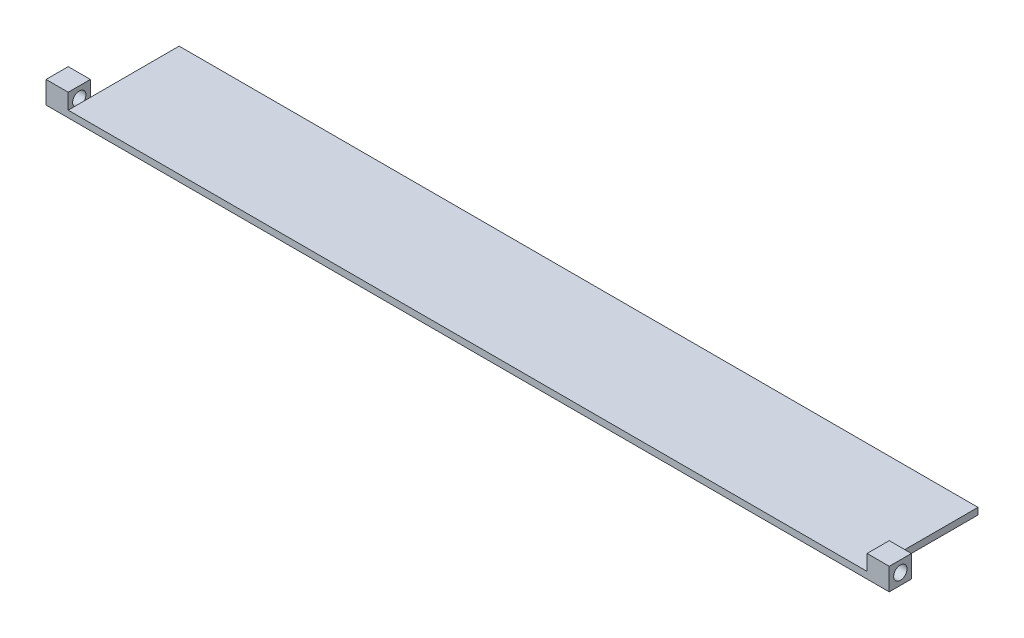
from build123d import *

# Parameters (mm, degrees)
SKIZZE1_W                       = 180
SKIZZE1_H                       = 25
AUFSATZ_LINEAR_AUSTRAGEN1_DEPTH = 1.5
SKIZZE2_W                       = 5
SKIZZE2_H                       = 5
AUFSATZ_LINEAR_AUSTRAGEN2_DEPTH = 5
SKIZZE3_R                       = 1.5
SCHNITT_LINEAR_AUSTRAGEN1_DEPTH = 5
SKIZZE4_W                       = 5
SKIZZE4_H                       = 5
AUFSATZ_LINEAR_AUSTRAGEN3_DEPTH = 5
SCHNITT_LINEAR_START            = -5
SKIZZE5_R                       = 1.5
SCHNITT_LINEAR_AUSTRAGEN2_DEPTH = 5


with BuildPart() as part:
    # Skizze1 → Aufsatz-Linear austragen1 (new body)
    with BuildSketch(Plane(origin=(0, 0, 0), x_dir=(1, 0, 0), z_dir=(0, 1, 0))):
        Rectangle(SKIZZE1_W, SKIZZE1_H)
    extrude(amount=AUFSATZ_LINEAR_AUSTRAGEN1_DEPTH)

    # Skizze2 → Aufsatz-Linear austragen2 (add)
    with BuildSketch(Plane(origin=(90, 0, 0), x_dir=(0, 0, -1), z_dir=(1, 0, 0))):
        with Locations((-10, 2.5)):
            Rectangle(SKIZZE2_W, SKIZZE2_H)
    extrude(amount=AUFSATZ_LINEAR_AUSTRAGEN2_DEPTH)

    # Skizze3 → Schnitt-Linear austragen1 (cut)
    with BuildSketch(Plane(origin=(95, 0, 0), x_dir=(0, 0, -1), z_dir=(1, 0, 0))):
        with Locations((-10, 2.5)):
            Circle(SKIZZE3_R)
    extrude(amount=-SCHNITT_LINEAR_AUSTRAGEN1_DEPTH, mode=Mode.SUBTRACT)

    # Skizze4 → Aufsatz-Linear austragen3 (add)
    with BuildSketch(Plane.ZY.offset(90)):
        with Locations((10, 2.5)):
            Rectangle(SKIZZE4_W, SKIZZE4_H)
    extrude(amount=AUFSATZ_LINEAR_AUSTRAGEN3_DEPTH)

    # Skizze5 → Schnitt-Linear austragen2 (cut)
    with BuildSketch(Plane.ZY.offset(95).offset(SCHNITT_LINEAR_START)):
        with Locations(Location((10, 2.5, 0), (0, 0, 180))):
            Circle(SKIZZE5_R)
    extrude(amount=SCHNITT_LINEAR_AUSTRAGEN2_DEPTH, mode=Mode.SUBTRACT)


solid = part.part
